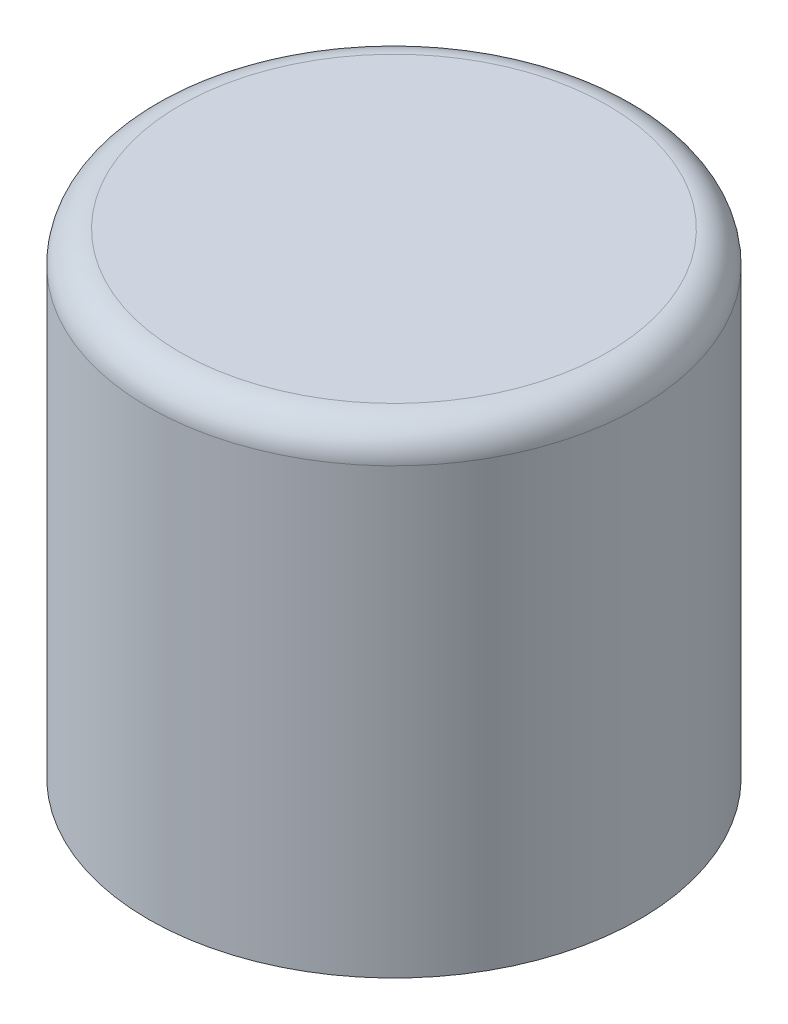
from build123d import *

# Parameters (mm, degrees)
SKETCH_1_R      = 3.1
SKETCH_1_R_2    = 1.7
EXTRUDE_1_DEPTH = 5
SKETCH_2_R      = 3.1
EXTRUDE_2_DEPTH = 1
FILLET_1_R      = 0.4


with BuildPart() as part:
    # 草图1 → 凸台-拉伸1 (new body)
    with BuildSketch(Plane(origin=(0, 0, 0), x_dir=(1, 0, 0), z_dir=(0, 1, 0))):
        with Locations(Location((0, 0, 0), (0, 0, 270))):
            Circle(SKETCH_1_R)
        with Locations(Location((0, 0, 0), (0, 0, 270))):
            Circle(SKETCH_1_R_2, mode=Mode.SUBTRACT)
    extrude(amount=EXTRUDE_1_DEPTH)

    # 草图2 → 凸台-拉伸2 (add)
    with BuildSketch(Plane(origin=(0, 5, 0), x_dir=(1, 0, 0), z_dir=(0, 1, 0))):
        with Locations(Location((0, 0, 0), (0, 0, 270))):
            Circle(SKETCH_2_R)
    extrude(amount=EXTRUDE_2_DEPTH)

    # 圆角1
    fillet_1_edges = [part.edges().sort_by_distance(p)[0] for p in [
        (0, 6, -3.1),
    ]]
    fillet(fillet_1_edges, radius=FILLET_1_R)


solid = part.part
